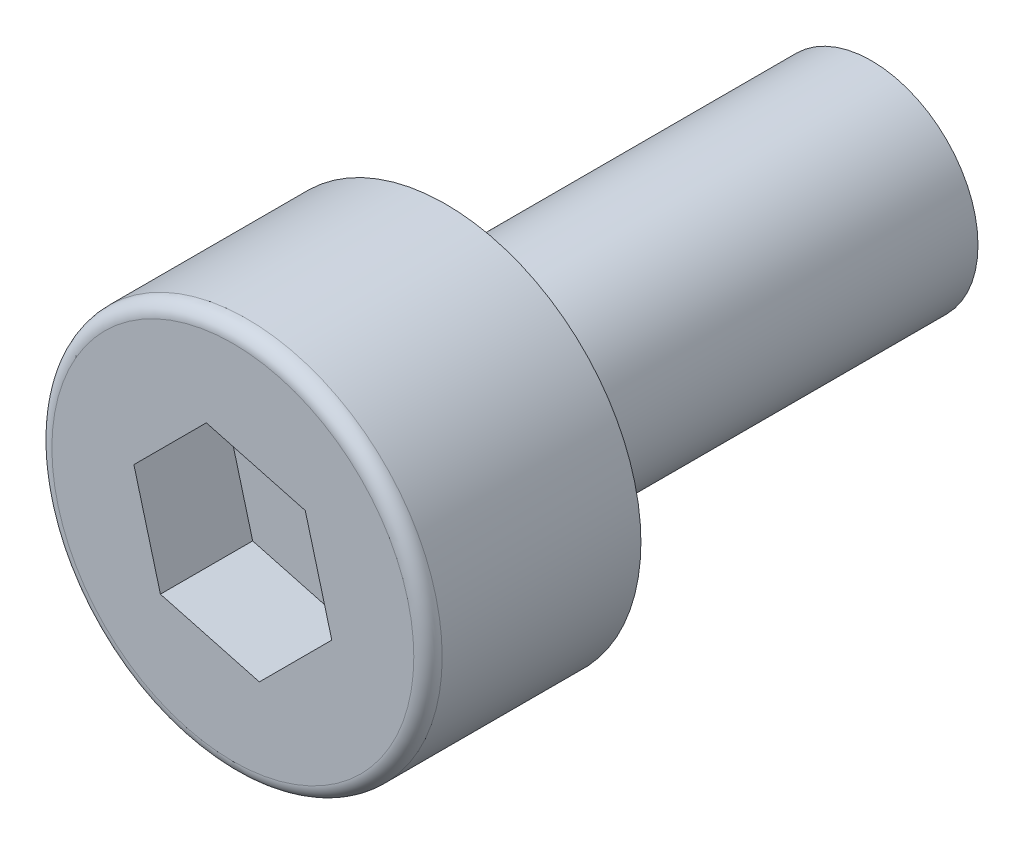
from build123d import *

# Parameters (mm, degrees)
SKETCH_1_R          = 2.75
EXTRUDE_1_DEPTH     = 3
CUT_EXTRUDE_1_DEPTH = 1.3
SKETCH_3_R          = 1.5
EXTRUDE_2_DEPTH     = 6
FILLET_1_R          = 0.2


with BuildPart() as part:
    # 草图1 → 凸台-拉伸1 (new body)
    with BuildSketch(Plane.XY):
        Circle(SKETCH_1_R)
    extrude(amount=EXTRUDE_1_DEPTH)

    # 草图2 → 切除-拉伸1 (cut)
    with BuildSketch(Plane.XY.offset(3)):
        Polygon((-1.020620726, -1.020620726), (0.373573113, -1.39419384), (1.39419384, -0.373573113), (1.020620726, 1.020620726), (-0.373573113, 1.39419384), (-1.39419384, 0.373573113), align=None)
    extrude(amount=-CUT_EXTRUDE_1_DEPTH, mode=Mode.SUBTRACT)

    # 草图3 → 凸台-拉伸2 (add)
    with BuildSketch(Plane(origin=(0, 0, 0), x_dir=(-1, 0, 0), z_dir=(0, 0, -1))):
        with Locations(Location((0, 0, 0), (0, 0, 180))):
            Circle(SKETCH_3_R)
    extrude(amount=EXTRUDE_2_DEPTH)

    # 圆角1
    fillet_1_edges = [part.edges().sort_by_distance(p)[0] for p in [
        (-2.75, 0, 3),
    ]]
    fillet(fillet_1_edges, radius=FILLET_1_R)


solid = part.part
